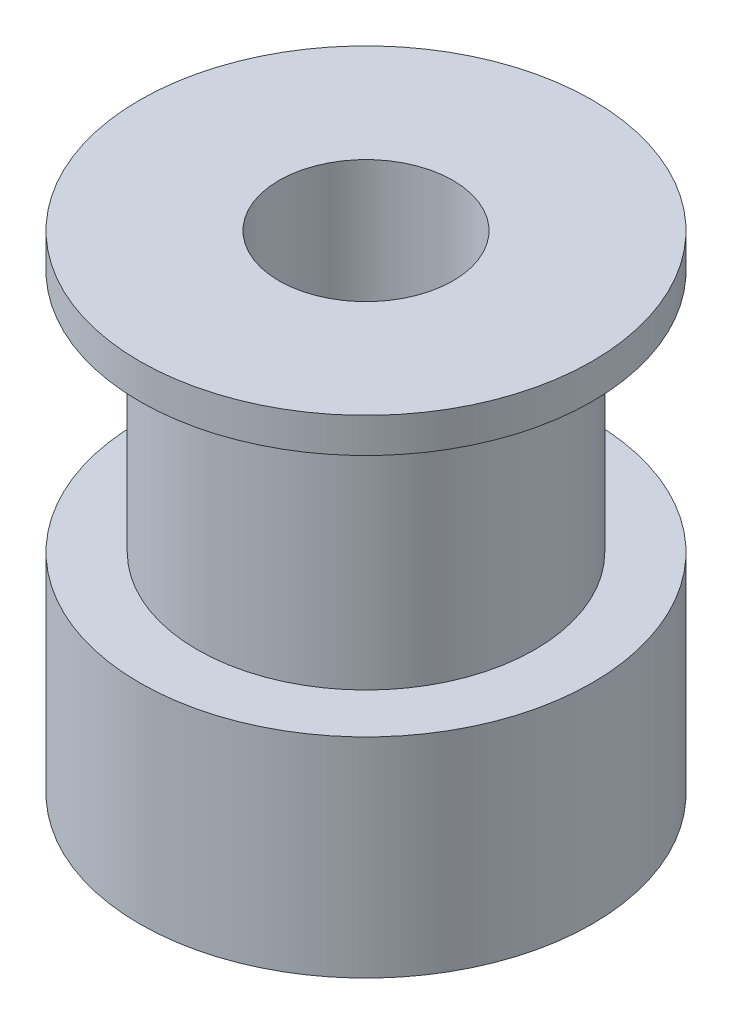
from build123d import *

# Parameters (mm, degrees)
SKETCH_1_R          = 6.5
EXTRUDE_1_DEPTH     = 6
SKETCH_2_R          = 4.85
EXTRUDE_2_DEPTH     = 7
SKETCH_3_R          = 6.5
EXTRUDE_3_DEPTH     = 1
CUT_EXTRUDE_1_REACH = 18.748
SKETCH_4_R          = 2.5


with BuildPart() as part:
    # 草图1 → 凸台-拉伸1 (new body)
    with BuildSketch(Plane(origin=(0, 0, 0), x_dir=(1, 0, 0), z_dir=(0, 1, 0))):
        with Locations(Location((0, 0, 0), (0, 0, 270))):
            Circle(SKETCH_1_R)
    extrude(amount=EXTRUDE_1_DEPTH)

    # 草图2 → 凸台-拉伸2 (add)
    with BuildSketch(Plane(origin=(0, 6, 0), x_dir=(1, 0, 0), z_dir=(0, 1, 0))):
        with Locations(Location((0, 0, 0), (0, 0, 270))):
            Circle(SKETCH_2_R)
    extrude(amount=EXTRUDE_2_DEPTH)

    # 草图3 → 凸台-拉伸3 (add)
    with BuildSketch(Plane(origin=(0, 13, 0), x_dir=(1, 0, 0), z_dir=(0, 1, 0))):
        with Locations(Location((0, 0, 0), (0, 0, 270))):
            Circle(SKETCH_3_R)
    extrude(amount=EXTRUDE_3_DEPTH)

    # 草图4 → 切除-拉伸1 (cut, up to next)
    with BuildSketch(Plane(origin=(0, 14, 0), x_dir=(1, 0, 0), z_dir=(0, 1, 0)), mode=Mode.PRIVATE) as cut_extrude_1_sk1:
        with Locations(Location((0, 0, 0), (0, 0, 270))):
            Circle(SKETCH_4_R)
    cut_extrude_1_tool1 = extrude(cut_extrude_1_sk1.sketch, amount=-CUT_EXTRUDE_1_REACH, mode=Mode.PRIVATE) & part.part
    add(cut_extrude_1_tool1.solids().sort_by_distance((0, 14, 0))[0], mode=Mode.SUBTRACT)


solid = part.part
